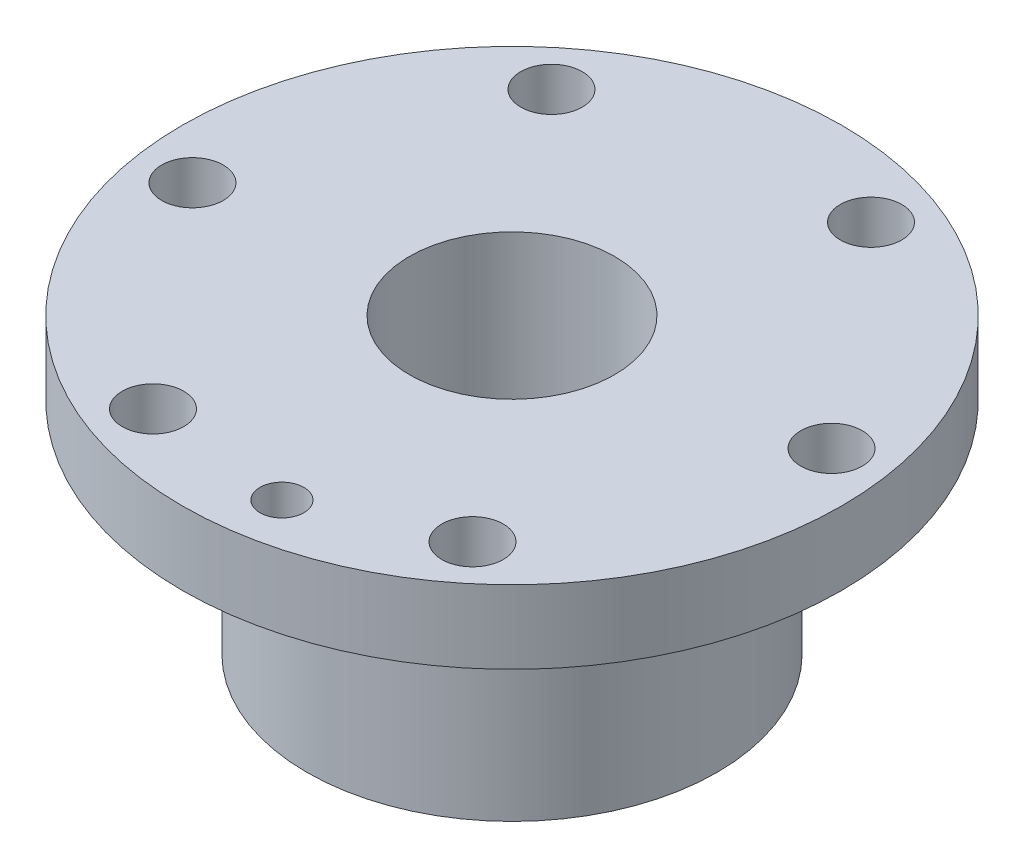
from build123d import *

# Parameters (mm, degrees)
SKETCH1_R           = 30
BOSS_EXTRUDE1_DEPTH = 5
SKETCH2_R           = 30
SKETCH2_R_2         = 22.5
SKETCH2_R_3         = 2.1
SKETCH2_R_4         = 1.5
CUT_EXTRUDE1_DEPTH  = 10
SKETCH3_R           = 14
BOSS_EXTRUDE2_DEPTH = 15
SKETCH4_R           = 2
CUT_EXTRUDE2_DEPTH  = 6
SKETCH5_R           = 7
CUT_EXTRUDE3_DEPTH  = 38.583240946


with BuildPart() as part:
    # Sketch1 → Boss-Extrude1 (new body)
    with BuildSketch(Plane(origin=(0, 0, 0), x_dir=(1, 0, 0), z_dir=(0, 1, 0))):
        with Locations(Location((0, 0, 0), (0, 0, 270))):
            Circle(SKETCH1_R)
    extrude(amount=BOSS_EXTRUDE1_DEPTH)

    # Sketch2 → Cut-Extrude1 (cut)
    # profile 1 of 8: a face of its own
    with BuildSketch(Plane(origin=(0, 0, 0), x_dir=(-1, 0, 0), z_dir=(0, -1, 0))):
        Circle(SKETCH2_R)
        with Locations(Location((0, 0, 0), (0, 0, 90))):
            Circle(SKETCH2_R_2, mode=Mode.SUBTRACT)
    # profile 2 of 8: a face of its own
    with BuildSketch(Plane(origin=(0, 0, 0), x_dir=(-1, 0, 0), z_dir=(0, -1, 0))):
        with Locations(Location((12.019973653, 14.714626511, 0), (0, 0, 90))):
            Circle(SKETCH2_R_3)
    # profile 3 of 8: a face of its own
    with BuildSketch(Plane(origin=(0, 0, 0), x_dir=(-1, 0, 0), z_dir=(0, -1, 0))):
        with Locations(Location((-6.733253539, 17.766915792, 0), (0, 0, 90))):
            Circle(SKETCH2_R_3)
    # profile 4 of 8: a face of its own
    with BuildSketch(Plane(origin=(0, 0, 0), x_dir=(-1, 0, 0), z_dir=(0, -1, 0))):
        with Locations(Location((-18.753227193, 3.052289281, 0), (0, 0, 90))):
            Circle(SKETCH2_R_3)
    # profile 5 of 8: a face of its own
    with BuildSketch(Plane(origin=(0, 0, 0), x_dir=(-1, 0, 0), z_dir=(0, -1, 0))):
        with Locations(Location((-12.019973653, -14.714626511, 0), (0, 0, 90))):
            Circle(SKETCH2_R_3)
    # profile 6 of 8: a face of its own
    with BuildSketch(Plane(origin=(0, 0, 0), x_dir=(-1, 0, 0), z_dir=(0, -1, 0))):
        with Locations(Location((-3.052289281, -18.753227193, 0), (0, 0, 90))):
            Circle(SKETCH2_R_4)
    # profile 7 of 8: a face of its own
    with BuildSketch(Plane(origin=(0, 0, 0), x_dir=(-1, 0, 0), z_dir=(0, -1, 0))):
        with Locations(Location((6.733253539, -17.766915792, 0), (0, 0, 90))):
            Circle(SKETCH2_R_3)
    # profile 8 of 8: a face of its own
    with BuildSketch(Plane(origin=(0, 0, 0), x_dir=(-1, 0, 0), z_dir=(0, -1, 0))):
        with Locations(Location((18.753227193, -3.052289281, 0), (0, 0, 90))):
            Circle(SKETCH2_R_3)
    extrude(amount=-CUT_EXTRUDE1_DEPTH, mode=Mode.SUBTRACT)

    # Sketch3 → Boss-Extrude2 (add)
    with BuildSketch(Plane.XZ):
        with Locations(Location((0, 0, 0), (0, 0, 90))):
            Circle(SKETCH3_R)
    extrude(amount=BOSS_EXTRUDE2_DEPTH)

    # Sketch4 → Cut-Extrude2 (cut)
    with BuildSketch(Plane.XZ.offset(15)):
        with Locations(Location((-0.978927697, 9.951969683, 0), (0, 0, 270))):
            Circle(SKETCH4_R)
        with Locations(Location((-9.951969683, -0.978927697, 0), (0, 0, 270))):
            Circle(SKETCH4_R)
        with Locations(Location((0.978927697, -9.951969683, 0), (0, 0, 270))):
            Circle(SKETCH4_R)
        with Locations(Location((9.951969683, 0.978927697, 0), (0, 0, 270))):
            Circle(SKETCH4_R)
    extrude(amount=-CUT_EXTRUDE2_DEPTH, mode=Mode.SUBTRACT)

    # Sketch5 → Cut-Extrude3 (cut, through all)
    with BuildSketch(Plane.XZ.offset(15)):
        with Locations(Location((0, 0, 0), (0, 0, 270))):
            Circle(SKETCH5_R)
    extrude(amount=-CUT_EXTRUDE3_DEPTH, mode=Mode.SUBTRACT)


solid = part.part
